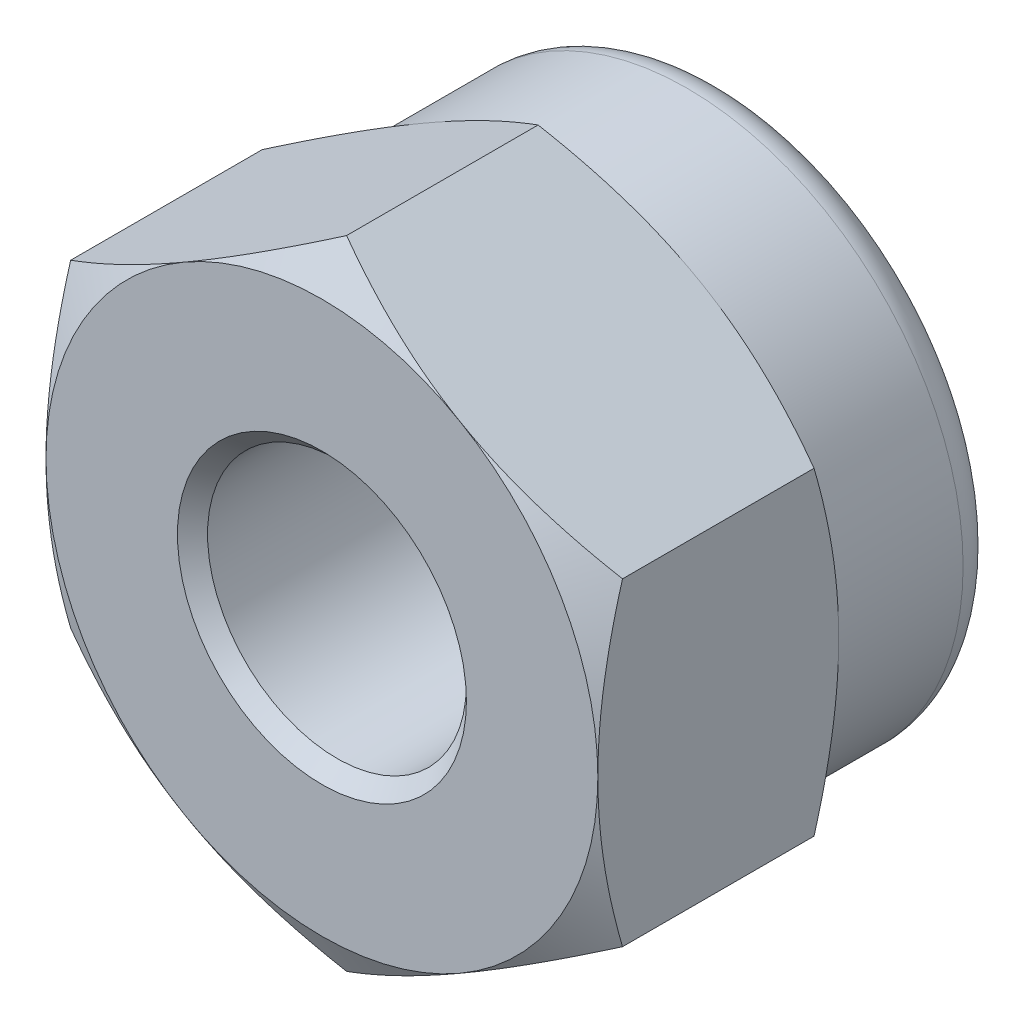
from build123d import *

# Parameters (mm, degrees)
SKETCH_1_R          = 1.29
EXTRUDE_1_DEPTH     = 2.4
SKETCH_5_R          = 2.75
SKETCH_5_R_2        = 1.65
EXTRUDE_4_DEPTH     = 1.6
FILLET_2_R          = 0.36
SKETCH_6_R          = 1.875
CUT_EXTRUDE_1_DEPTH = 0.4
CHAMFER_2_SIZE      = 0.15


with BuildPart() as part:
    # 草图1 → 凸台-拉伸1 (new body)
    with BuildSketch(Plane.XY):
        Polygon((0, 3.175426481), (-2.75, 1.58771324), (-2.75, -1.58771324), (0, -3.175426481), (2.75, -1.58771324), (2.75, 1.58771324), align=None)
        Circle(SKETCH_1_R, mode=Mode.SUBTRACT)
    extrude(amount=-EXTRUDE_1_DEPTH)

    # 草图2 → 切除-旋转1 (revolve, cut)
    with BuildSketch(Plane(origin=(0, 0, 0), x_dir=(0, 0, -1), z_dir=(1, 0, 0))):
        Polygon((0, 2.75), (0.245620093, 3.175426481), (0, 3.175426481), align=None)
        Polygon((2.4, 2.75), (2.154379907, 3.175426481), (2.4, 3.175426481), align=None)
    revolve(axis=Axis((0, 0, 0), (0, 0, -1)), mode=Mode.SUBTRACT)

    # 草图5 → 凸台-拉伸4 (add)
    with BuildSketch(Plane(origin=(0, 0, -2.4), x_dir=(-1, 0, 0), z_dir=(0, 0, -1))):
        Circle(SKETCH_5_R)
        Circle(SKETCH_5_R_2, mode=Mode.SUBTRACT)
    extrude(amount=EXTRUDE_4_DEPTH)

    # 圆角2
    fillet_2_edges = [part.edges().sort_by_distance(p)[0] for p in [
        (2.75, 0, -4),
    ]]
    fillet(fillet_2_edges, radius=FILLET_2_R)

    # 草图6 → 切除-拉伸1 (cut)
    with BuildSketch(Plane(origin=(0, 0, -4), x_dir=(-1, 0, 0), z_dir=(0, 0, -1))):
        Circle(SKETCH_6_R)
    extrude(amount=-CUT_EXTRUDE_1_DEPTH, mode=Mode.SUBTRACT)

    # 倒角2
    chamfer_2_edges = [part.edges().sort_by_distance(p)[0] for p in [
        (-1.29, 0, -2.4),
        (-1.29, 0, 0),
    ]]
    chamfer(chamfer_2_edges, length=CHAMFER_2_SIZE)


solid = part.part
